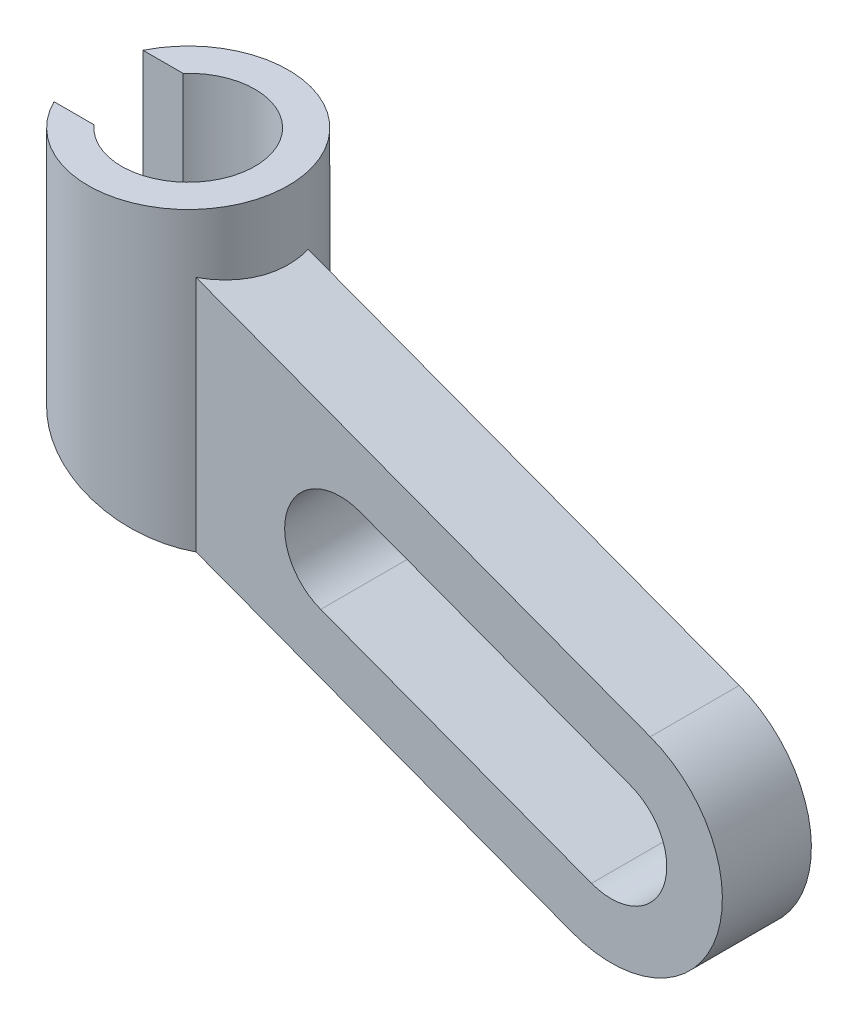
from build123d import *

# Parameters (mm, degrees)
EXTRUDE_1_DEPTH      = 3
EXTRUDE_1_DEPTH_BACK = 1
SKETCH_2_R           = 4.5
SKETCH_2_R_2         = 3
EXTRUDE_2_DEPTH      = 20
SKETCH_3_R           = 3
CUT_EXTRUDE_1_DEPTH  = 34.900589965
CUT_EXTRUDE_2_REACH  = 35.901
SKETCH_4_R           = 9.774013962
SKETCH_5_W           = 13.881504323
SKETCH_5_H           = 4
CUT_EXTRUDE_4_DEPTH  = 34.900589965


with BuildPart() as part:
    # Эскиз1 → Бобышка-Вытянуть1 (new, two sides: drawn at the far end of the back side and taken through both)
    with BuildSketch(Plane.XY.offset(-EXTRUDE_1_DEPTH_BACK)):
        with BuildLine():
            Line((23.759671021, 9.680123705), (0, 18.61347829))
            Line((0, 18.61347829), (0, 7.93))
            Line((0, 7.93), (20.240328979, 0.319876295))
            ThreePointArc((20.240328979, 0.319876295), (26.680123705, 3.240328979), (23.759671021, 9.680123705))
        make_face()
        with BuildLine():
            Line((8.951842855, 7.235082801), (21.12016449, 2.659938147))
            ThreePointArc((21.12016449, 2.659938147), (24.340061853, 4.12016449), (22.87983551, 7.340061853))
            Line((22.87983551, 7.340061853), (10.711513876, 11.915206507))
            ThreePointArc((10.711513876, 11.915206507), (7.491616513, 10.454980164), (8.951842855, 7.235082801))
        make_face(mode=Mode.SUBTRACT)
    extrude(amount=EXTRUDE_1_DEPTH + EXTRUDE_1_DEPTH_BACK)

    # Эскиз2 → Бобышка-Вытянуть2 (add)
    with BuildSketch(Plane(origin=(0, 0, 0), x_dir=(1, 0, 0), z_dir=(0, 1, 0))):
        with Locations(Location((0, 0, 0), (0, 0, 270))):
            Circle(SKETCH_2_R)
        with Locations(Location((0, 0, 0), (0, 0, 270))):
            Circle(SKETCH_2_R_2, mode=Mode.SUBTRACT)
    extrude(amount=EXTRUDE_2_DEPTH)

    # Эскиз3 → Вырез-Вытянуть1 (cut, through all)
    with BuildSketch(Plane(origin=(0, 0, 0), x_dir=(-1, 0, 0), z_dir=(0, -1, 0))):
        with Locations(Location((0, 0, 0), (0, 0, 270))):
            Circle(SKETCH_3_R)
    extrude(amount=-CUT_EXTRUDE_1_DEPTH, mode=Mode.SUBTRACT)

    # Вырез-Вытянуть2: up to this face of the body (flat: up to its plane)
    cut_extrude_2_end = Plane(part.part.faces().sort_by_distance((12.227229865, 3.33270655, 1.020399835))[0])
    # Эскиз4 → Вырез-Вытянуть2 (cut, up to the picked face)
    with BuildSketch(Plane.XZ, mode=Mode.PRIVATE) as cut_extrude_2_sk1:
        Circle(SKETCH_4_R)
    cut_extrude_2_tool1 = split(extrude(cut_extrude_2_sk1.sketch, amount=-CUT_EXTRUDE_2_REACH, mode=Mode.PRIVATE), bisect_by=cut_extrude_2_end, keep=Keep.BOTH, mode=Mode.PRIVATE)
    add(cut_extrude_2_tool1.solids().sort_by(Axis((0, 0, 0), (0, 1, 0)))[0], mode=Mode.SUBTRACT)

    # Эскиз5 → Вырез-Вытянуть4 (cut, through all)
    with BuildSketch(Plane(origin=(0, 0, 0), x_dir=(1, 0, 0), z_dir=(0, 1, 0))):
        with Locations((-7.880628676, 0)):
            Rectangle(SKETCH_5_W, SKETCH_5_H)
    extrude(amount=CUT_EXTRUDE_4_DEPTH, mode=Mode.SUBTRACT)


solid = part.part
